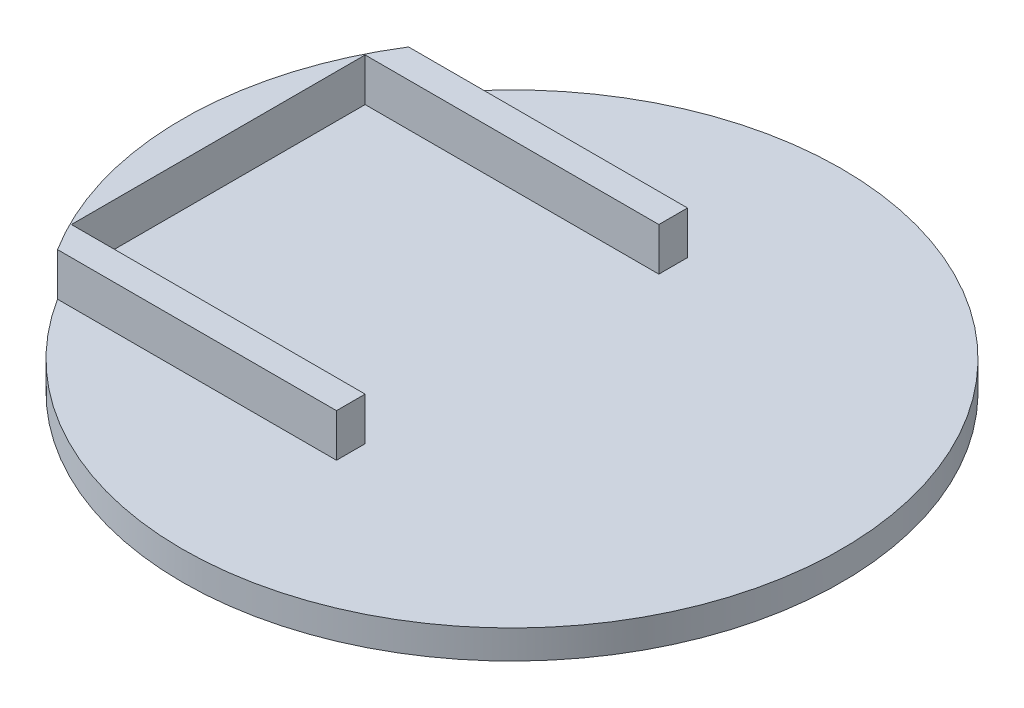
from build123d import *

# Parameters (mm, degrees)
SKETCH1_R           = 23
BOSS_EXTRUDE1_DEPTH = 2
SKETCH3_R           = 0.5
CUT_EXTRUDE2_DEPTH  = 1
BOSS_EXTRUDE2_DEPTH = 5


with BuildPart() as part:
    # Sketch1 → Boss-Extrude1 (new body)
    with BuildSketch(Plane(origin=(0, 0, 0), x_dir=(1, 0, 0), z_dir=(0, 1, 0))):
        with Locations(Location((0, 0, 0), (0, 0, 270))):
            Circle(SKETCH1_R)
    extrude(amount=BOSS_EXTRUDE1_DEPTH)

    # Sketch3 → Cut-Extrude2 (cut)
    with BuildSketch(Plane(origin=(0, 0, 0), x_dir=(1, 0, 0), z_dir=(0, 1, 0))):
        with Locations(Location((0, 0, 0), (0, 0, 270))):
            Circle(SKETCH3_R)
    extrude(amount=CUT_EXTRUDE2_DEPTH, mode=Mode.SUBTRACT)

    # Sketch4 → Boss-Extrude2 (add)
    with BuildSketch(Plane(origin=(0, 0, 0), x_dir=(1, 0, 0), z_dir=(0, 1, 0))):
        with BuildLine():
            Line((0, 10.25), (0, 12.25))
            Line((0, 12.25), (-19.466317063, 12.25))
            ThreePointArc((-19.466317063, 12.25), (-23, 0), (-19.466317063, -12.25))
            Line((-19.466317063, -12.25), (0, -12.25))
            Line((0, -12.25), (0, -10.25))
            Line((0, -10.25), (-20.5, -10.25))
            Line((-20.5, -10.25), (-20.5, 10.25))
            Line((-20.5, 10.25), (0, 10.25))
        make_face()
    extrude(amount=BOSS_EXTRUDE2_DEPTH)


solid = part.part
